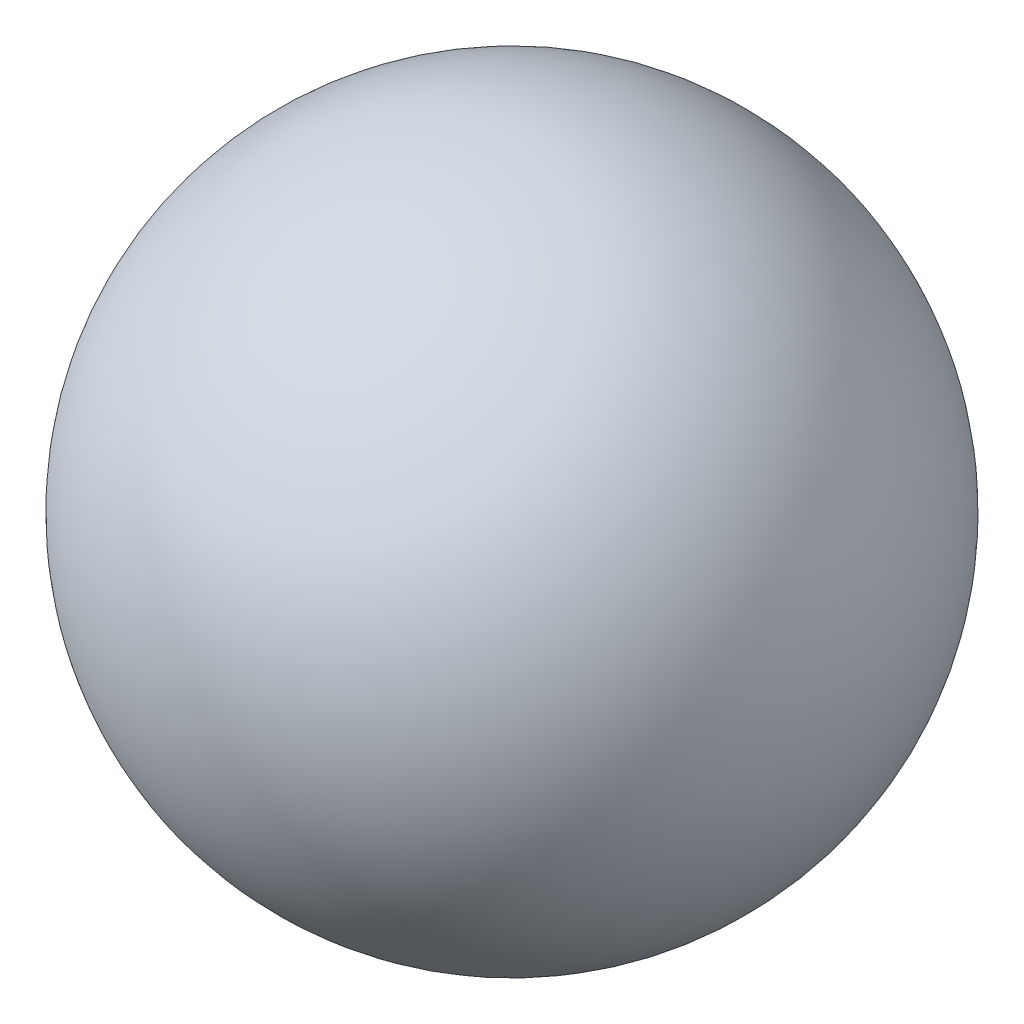
from build123d import *


with BuildPart() as part:
    # Sketch1 → Revolve2 (revolve)
    with BuildSketch(Plane(origin=(0, 0, 0), x_dir=(1, 0, 0), z_dir=(0, 1, 0))):
        with BuildLine():
            Line((0, -4.7625), (0, 4.7625))
            ThreePointArc((0, 4.7625), (-4.7625, 0), (0, -4.7625))
        make_face()
    revolve(axis=Axis((0, 0, -9.035050831), (0, 0, 1)))


solid = part.part
